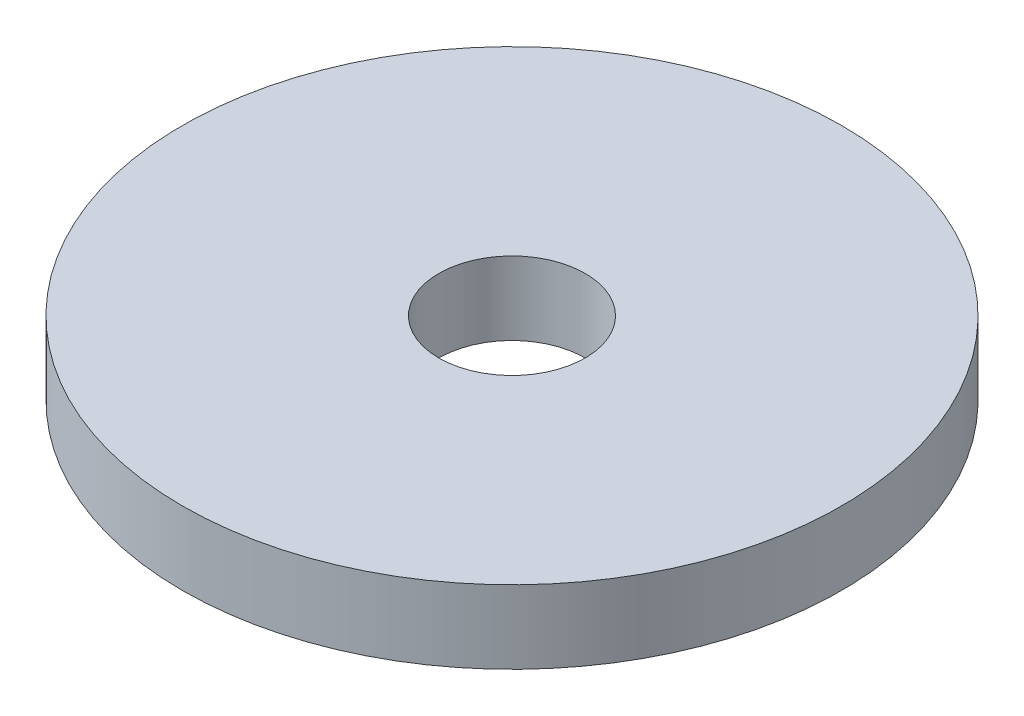
from build123d import *

# Parameters (mm, degrees)
SKETCH_1_R      = 9
SKETCH_1_R_2    = 2
EXTRUDE_1_DEPTH = 2


with BuildPart() as part:
    # 草图1 → 凸台-拉伸1 (new body)
    with BuildSketch(Plane(origin=(0, 0, 0), x_dir=(1, 0, 0), z_dir=(0, 1, 0))):
        with Locations(Location((0, 0, 0), (0, 0, 270))):
            Circle(SKETCH_1_R)
        with Locations(Location((0, 0, 0), (0, 0, 270))):
            Circle(SKETCH_1_R_2, mode=Mode.SUBTRACT)
    extrude(amount=EXTRUDE_1_DEPTH)


solid = part.part
